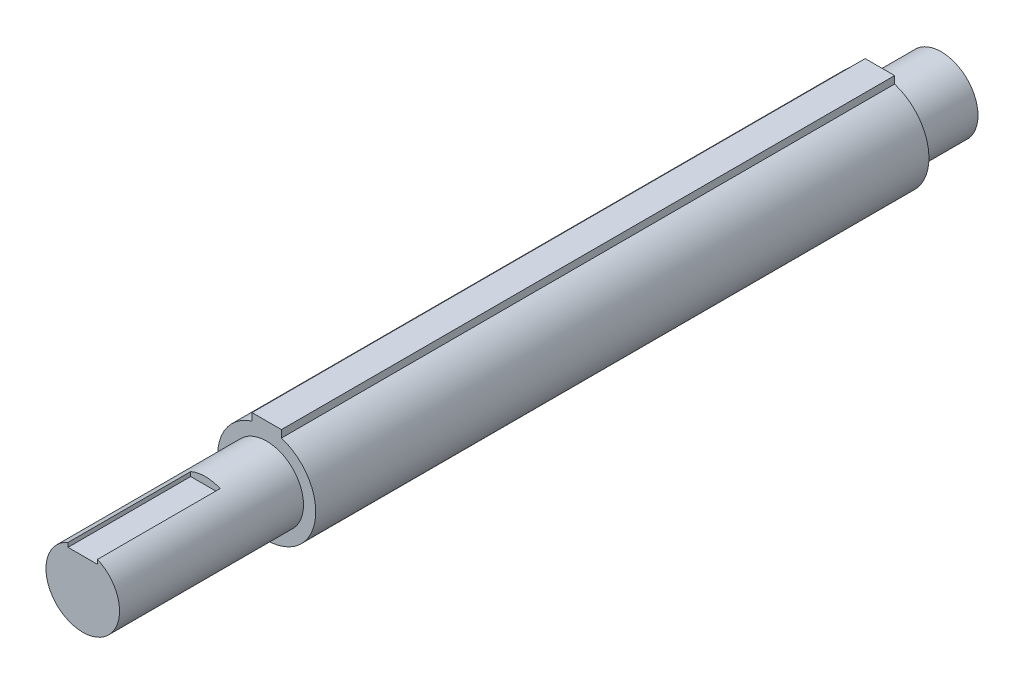
from build123d import *

# Parameters (mm, degrees)
BOSS_EXTRUDE1_DEPTH = 250
SKETCH2_R           = 15
BOSS_EXTRUDE2_DEPTH = 75
BOSS_EXTRUDE3_START = 25
SKETCH3_R           = 15
BOSS_EXTRUDE3_DEPTH = 25
SKETCH4_W           = 12
SKETCH4_H           = 6
CUT_EXTRUDE1_DEPTH  = 50


with BuildPart() as part:
    # Sketch1 → Boss-Extrude1 (new body)
    with BuildSketch(Plane.XY):
        with BuildLine():
            ThreePointArc((0, -20), (19.76835465, -3.035153115), (5.999998319, 19.078784557))
            Line((5.999998319, 19.078784557), (5.999998378, 22.078784557))
            Line((5.999998378, 22.078784557), (0, 22.078784557))
            Line((0, 22.078784557), (0, -20))
        make_face()
        with BuildLine():
            ThreePointArc((-6.000001681, 19.0787835), (-19.768354383, -3.035154857), (0, -20))
            Line((0, -20), (0, 22.078784557))
            Line((0, 22.078784557), (-6.000001622, 22.078784557))
            Line((-6.000001622, 22.078784557), (-6.000001681, 19.0787835))
        make_face()
    extrude(amount=-BOSS_EXTRUDE1_DEPTH)

    # Sketch2 → Boss-Extrude2 (add)
    with BuildSketch(Plane.XY):
        Circle(SKETCH2_R)
    extrude(amount=BOSS_EXTRUDE2_DEPTH)

    # Sketch3 → Boss-Extrude3 (add)
    with BuildSketch(Plane(origin=(0, 0, -250), x_dir=(-1, 0, 0), z_dir=(0, 0, -1)).offset(BOSS_EXTRUDE3_START)):
        with Locations(Location((0, 0, 0), (0, 0, 180))):
            Circle(SKETCH3_R)
    extrude(amount=-BOSS_EXTRUDE3_DEPTH)

    # Sketch4 → Cut-Extrude1 (cut)
    with BuildSketch(Plane.XY.offset(75)):
        with Locations((0, 15)):
            Rectangle(SKETCH4_W, SKETCH4_H)
    extrude(amount=-CUT_EXTRUDE1_DEPTH, mode=Mode.SUBTRACT)


solid = part.part
